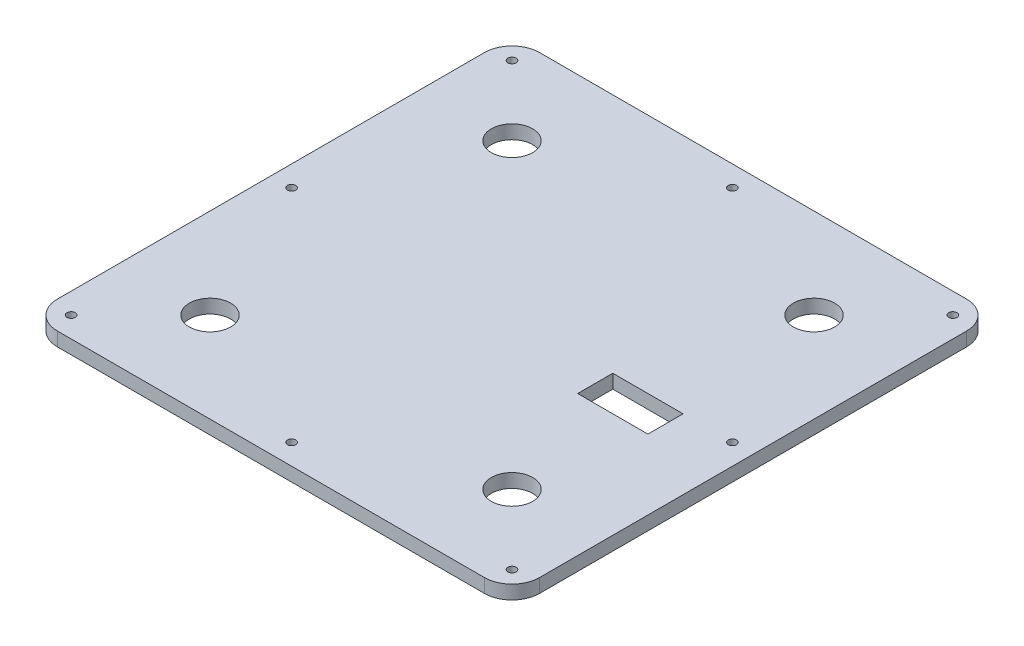
from build123d import *

# Parameters (mm, degrees)
SKETCH1_R                                       = 15
BOSS_EXTRUDE1_DEPTH                             = 10
CSK_FOR_M6_FLAT_HEAD_MACHINE_SCREW2_D           = 6
CSK_FOR_M6_FLAT_HEAD_MACHINE_SCREW2_CSINK_D     = 12.6
CSK_FOR_M6_FLAT_HEAD_MACHINE_SCREW2_CSINK_ANGLE = 90
SKETCH6_W                                       = 51
SKETCH6_H                                       = 25.5
CUT_EXTRUDE1_DEPTH                              = 10


with BuildPart() as part:
    # Sketch1 → Boss-Extrude1 (new body)
    with BuildSketch(Plane(origin=(0, 0, 0), x_dir=(1, 0, 0), z_dir=(0, 1, 0))):
        with BuildLine():
            Line((-155, 175), (155, 175))
            ThreePointArc((155, 175), (169.142135624, 169.142135624), (175, 155))
            Line((175, 155), (175, -155))
            ThreePointArc((175, -155), (169.142135624, -169.142135624), (155, -175))
            Line((155, -175), (-155, -175))
            ThreePointArc((-155, -175), (-169.142135624, -169.142135624), (-175, -155))
            Line((-175, -155), (-175, 155))
            ThreePointArc((-175, 155), (-169.142135624, 169.142135624), (-155, 175))
        make_face()
        with Locations(Location((-109.601551084, 109.601551084, 0), (0, 0, 270))):
            Circle(SKETCH1_R, mode=Mode.SUBTRACT)
        with Locations(Location((109.601551084, 109.601551084, 0), (0, 0, 270))):
            Circle(SKETCH1_R, mode=Mode.SUBTRACT)
        with Locations(Location((-109.601551084, -109.601551084, 0), (0, 0, 270))):
            Circle(SKETCH1_R, mode=Mode.SUBTRACT)
        with Locations(Location((109.601551084, -109.601551084, 0), (0, 0, 270))):
            Circle(SKETCH1_R, mode=Mode.SUBTRACT)
    extrude(amount=BOSS_EXTRUDE1_DEPTH)

    # CSK for M6 Flat Head Machine Screw2 (through all)
    with Locations(Plane(origin=(160, 0, -160), x_dir=(0, 0, -1), z_dir=(0, -1, 0))):
        with Locations((0, 0), (-160, 0), (-320, 0), (-320, -160), (-320, -320), (-160, -320), (0, -320), (0, -160)):
            CounterSinkHole(CSK_FOR_M6_FLAT_HEAD_MACHINE_SCREW2_D / 2, CSK_FOR_M6_FLAT_HEAD_MACHINE_SCREW2_CSINK_D / 2, counter_sink_angle=CSK_FOR_M6_FLAT_HEAD_MACHINE_SCREW2_CSINK_ANGLE)

    # Sketch6 → Cut-Extrude1 (cut)
    with BuildSketch(Plane(origin=(0, 10, 0), x_dir=(1, 0, 0), z_dir=(0, 1, 0))):
        with Locations((98.666512481, -12.75)):
            Rectangle(SKETCH6_W, SKETCH6_H)
    extrude(amount=-CUT_EXTRUDE1_DEPTH, mode=Mode.SUBTRACT)


solid = part.part
